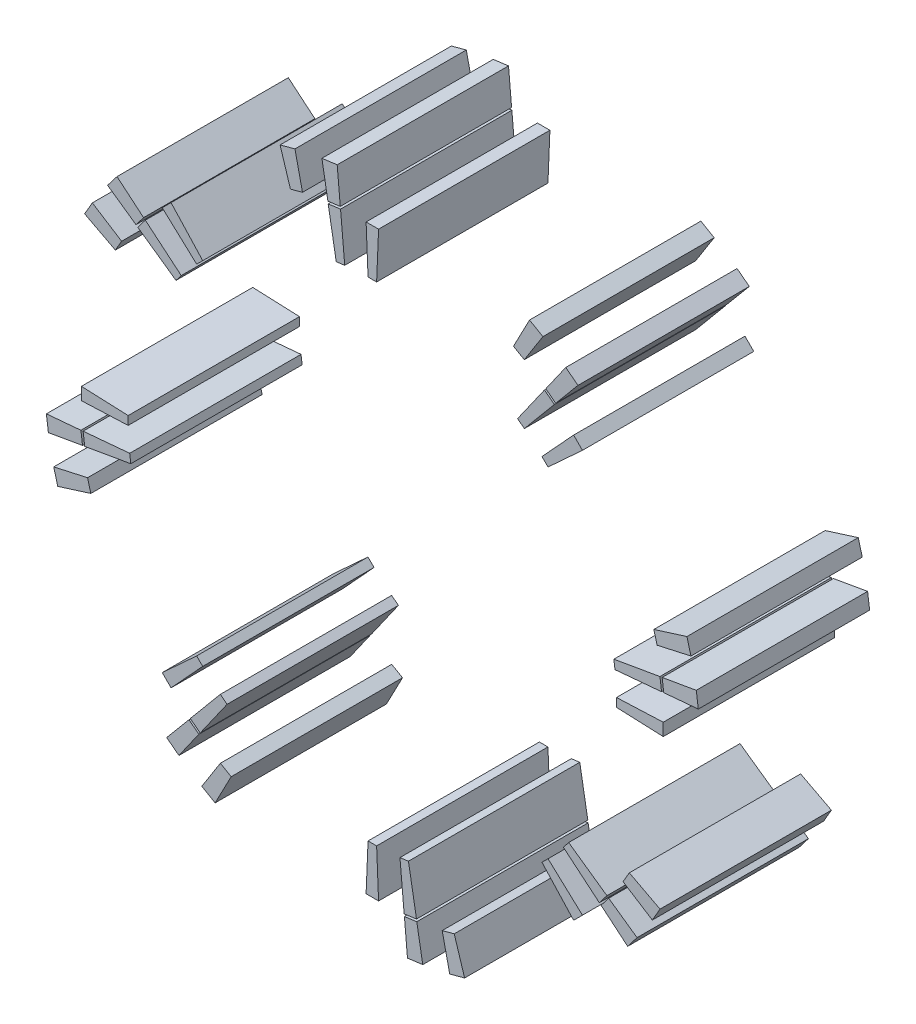
from build123d import *

# Parameters (mm, degrees)
SLOT_COPPER_ENVELOPES_START    = -15
SLOT_COPPER_ENVELOPES_DEPTH    = 30
SLOT_COPPER_ENVELOPES_2_DEPTH  = 30
SLOT_COPPER_ENVELOPES_3_DEPTH  = 30
SLOT_COPPER_ENVELOPES_4_DEPTH  = 30
SLOT_COPPER_ENVELOPES_5_DEPTH  = 30
SLOT_COPPER_ENVELOPES_6_DEPTH  = 30
SLOT_COPPER_ENVELOPES_7_DEPTH  = 30
SLOT_COPPER_ENVELOPES_8_DEPTH  = 30
SLOT_COPPER_ENVELOPES_9_DEPTH  = 30
SLOT_COPPER_ENVELOPES_10_DEPTH = 30
SLOT_COPPER_ENVELOPES_11_DEPTH = 30
SLOT_COPPER_ENVELOPES_12_DEPTH = 30
SLOT_COPPER_ENVELOPES_13_DEPTH = 30
SLOT_COPPER_ENVELOPES_14_DEPTH = 30
SLOT_COPPER_ENVELOPES_15_DEPTH = 30
SLOT_COPPER_ENVELOPES_16_DEPTH = 30
SLOT_COPPER_ENVELOPES_17_DEPTH = 30
SLOT_COPPER_ENVELOPES_18_DEPTH = 30
SLOT_COPPER_ENVELOPES_19_DEPTH = 30
SLOT_COPPER_ENVELOPES_20_DEPTH = 30
SLOT_COPPER_ENVELOPES_21_DEPTH = 30
SLOT_COPPER_ENVELOPES_22_DEPTH = 30
SLOT_COPPER_ENVELOPES_23_DEPTH = 30
SLOT_COPPER_ENVELOPES_24_DEPTH = 30
SLOT_COPPER_ENVELOPES_25_DEPTH = 30
SLOT_COPPER_ENVELOPES_26_DEPTH = 30
SLOT_COPPER_ENVELOPES_27_DEPTH = 30
SLOT_COPPER_ENVELOPES_28_DEPTH = 30
SLOT_COPPER_ENVELOPES_29_DEPTH = 30
SLOT_COPPER_ENVELOPES_30_DEPTH = 30
SLOT_COPPER_ENVELOPES_31_DEPTH = 30
SLOT_COPPER_ENVELOPES_32_DEPTH = 30


with BuildPart() as part:
    # Эскиз1 → Slot_copper_envelopes (new body)
    with BuildSketch(Plane.XY.offset(SLOT_COPPER_ENVELOPES_START)):
        Polygon((42.754960783, -0.75), (50.938461538, -1.091818182), (50.938461538, 1.091818182), (42.754960783, 0.75), align=None)
    extrude(amount=SLOT_COPPER_ENVELOPES_DEPTH)


with BuildPart() as body_2:
    # Эскиз1 → Slot_copper_envelopes 2 (new body)
    with BuildSketch(Plane.XY.offset(SLOT_COPPER_ENVELOPES_START)):
        Polygon((51.030252894, 5.617020808), (57.077518903, 6.152748823), (56.725098184, 8.829649949), (50.745231154, 7.78197586), align=None)
    extrude(amount=SLOT_COPPER_ENVELOPES_2_DEPTH)


with BuildPart() as body_3:
    # Эскиз1 → Slot_copper_envelopes 3 (new body)
    with BuildSketch(Plane.XY.offset(SLOT_COPPER_ENVELOPES_START)):
        Polygon((42.487080811, 4.837058584), (50.645186808, 5.566325896), (50.360165069, 7.731280948), (42.291291523, 6.324225876), align=None)
    extrude(amount=SLOT_COPPER_ENVELOPES_3_DEPTH)


with BuildPart() as body_4:
    # Эскиз1 → Slot_copper_envelopes 4 (new body)
    with BuildSketch(Plane.XY.offset(SLOT_COPPER_ENVELOPES_START)):
        Polygon((49.860513668, 12.229751015), (55.786117941, 13.550222408), (55.087306519, 16.158222139), (49.29534699, 14.338981773), align=None)
    extrude(amount=SLOT_COPPER_ENVELOPES_4_DEPTH)


with BuildPart() as body_5:
    # Эскиз1 → Slot_copper_envelopes 5 (new body)
    with BuildSketch(Plane.XY.offset(SLOT_COPPER_ENVELOPES_START)):
        Polygon((30.762652785, 29.701992613), (36.790963617, 35.246899537), (35.246899537, 36.790963617), (29.701992613, 30.762652785), align=None)
    extrude(amount=SLOT_COPPER_ENVELOPES_5_DEPTH)


with BuildPart() as body_6:
    # Эскиз1 → Slot_copper_envelopes 6 (new body)
    with BuildSketch(Plane.XY.offset(SLOT_COPPER_ENVELOPES_START)):
        Polygon((32.112004363, 40.05567137), (36.009250254, 44.710551086), (33.867196235, 46.354206944), (30.37960916, 41.384984963), align=None)
    extrude(amount=SLOT_COPPER_ENVELOPES_6_DEPTH)


with BuildPart() as body_7:
    # Эскиз1 → Slot_copper_envelopes 7 (new body)
    with BuildSketch(Plane.XY.offset(SLOT_COPPER_ENVELOPES_START)):
        Polygon((26.622586029, 33.46321988), (31.875568239, 39.747541814), (30.143173036, 41.076855407), (25.432556019, 34.376362023), align=None)
    extrude(amount=SLOT_COPPER_ENVELOPES_7_DEPTH)


with BuildPart() as body_8:
    # Эскиз1 → Slot_copper_envelopes 8 (new body)
    with BuildSketch(Plane.XY.offset(SLOT_COPPER_ENVELOPES_START)):
        Polygon((26.608967454, 43.904447203), (29.865288141, 49.028196443), (27.527019551, 50.378196443), (24.71788289, 44.996265385), align=None)
    extrude(amount=SLOT_COPPER_ENVELOPES_8_DEPTH)


with BuildPart() as body_9:
    # Эскиз1 → Slot_copper_envelopes 9 (new body)
    with BuildSketch(Plane.XY.offset(SLOT_COPPER_ENVELOPES_START)):
        Polygon((0.75, 42.754960783), (1.091818182, 50.938461538), (-1.091818182, 50.938461538), (-0.75, 42.754960783), align=None)
    extrude(amount=SLOT_COPPER_ENVELOPES_9_DEPTH)


with BuildPart() as body_10:
    # Эскиз1 → Slot_copper_envelopes 10 (new body)
    with BuildSketch(Plane.XY.offset(SLOT_COPPER_ENVELOPES_START)):
        Polygon((-5.617020808, 51.030252894), (-6.152748823, 57.077518903), (-8.829649949, 56.725098184), (-7.78197586, 50.745231154), align=None)
    extrude(amount=SLOT_COPPER_ENVELOPES_10_DEPTH)


with BuildPart() as body_11:
    # Эскиз1 → Slot_copper_envelopes 11 (new body)
    with BuildSketch(Plane.XY.offset(SLOT_COPPER_ENVELOPES_START)):
        Polygon((-4.837058584, 42.487080811), (-5.566325896, 50.645186808), (-7.731280948, 50.360165069), (-6.324225876, 42.291291523), align=None)
    extrude(amount=SLOT_COPPER_ENVELOPES_11_DEPTH)


with BuildPart() as body_12:
    # Эскиз1 → Slot_copper_envelopes 12 (new body)
    with BuildSketch(Plane.XY.offset(SLOT_COPPER_ENVELOPES_START)):
        Polygon((-12.229751015, 49.860513668), (-13.550222408, 55.786117941), (-16.158222139, 55.087306519), (-14.338981773, 49.29534699), align=None)
    extrude(amount=SLOT_COPPER_ENVELOPES_12_DEPTH)


with BuildPart() as body_13:
    # Эскиз1 → Slot_copper_envelopes 13 (new body)
    with BuildSketch(Plane.XY.offset(SLOT_COPPER_ENVELOPES_START)):
        Polygon((-29.701992613, 30.762652785), (-35.246899537, 36.790963617), (-36.790963617, 35.246899537), (-30.762652785, 29.701992613), align=None)
    extrude(amount=SLOT_COPPER_ENVELOPES_13_DEPTH)


with BuildPart() as body_14:
    # Эскиз1 → Slot_copper_envelopes 14 (new body)
    with BuildSketch(Plane.XY.offset(SLOT_COPPER_ENVELOPES_START)):
        Polygon((-40.05567137, 32.112004363), (-44.710551086, 36.009250254), (-46.354206944, 33.867196235), (-41.384984963, 30.37960916), align=None)
    extrude(amount=SLOT_COPPER_ENVELOPES_14_DEPTH)


with BuildPart() as body_15:
    # Эскиз1 → Slot_copper_envelopes 15 (new body)
    with BuildSketch(Plane.XY.offset(SLOT_COPPER_ENVELOPES_START)):
        Polygon((-33.46321988, 26.622586029), (-39.747541814, 31.875568239), (-41.076855407, 30.143173036), (-34.376362023, 25.432556019), align=None)
    extrude(amount=SLOT_COPPER_ENVELOPES_15_DEPTH)


with BuildPart() as body_16:
    # Эскиз1 → Slot_copper_envelopes 16 (new body)
    with BuildSketch(Plane.XY.offset(SLOT_COPPER_ENVELOPES_START)):
        Polygon((-43.904447203, 26.608967454), (-49.028196443, 29.865288141), (-50.378196443, 27.527019551), (-44.996265385, 24.71788289), align=None)
    extrude(amount=SLOT_COPPER_ENVELOPES_16_DEPTH)


with BuildPart() as body_17:
    # Эскиз1 → Slot_copper_envelopes 17 (new body)
    with BuildSketch(Plane.XY.offset(SLOT_COPPER_ENVELOPES_START)):
        Polygon((-42.754960783, 0.75), (-50.938461538, 1.091818182), (-50.938461538, -1.091818182), (-42.754960783, -0.75), align=None)
    extrude(amount=SLOT_COPPER_ENVELOPES_17_DEPTH)


with BuildPart() as body_18:
    # Эскиз1 → Slot_copper_envelopes 18 (new body)
    with BuildSketch(Plane.XY.offset(SLOT_COPPER_ENVELOPES_START)):
        Polygon((-51.030252894, -5.617020808), (-57.077518903, -6.152748823), (-56.725098184, -8.829649949), (-50.745231154, -7.78197586), align=None)
    extrude(amount=SLOT_COPPER_ENVELOPES_18_DEPTH)


with BuildPart() as body_19:
    # Эскиз1 → Slot_copper_envelopes 19 (new body)
    with BuildSketch(Plane.XY.offset(SLOT_COPPER_ENVELOPES_START)):
        Polygon((-42.487080811, -4.837058584), (-50.645186808, -5.566325896), (-50.360165069, -7.731280948), (-42.291291523, -6.324225876), align=None)
    extrude(amount=SLOT_COPPER_ENVELOPES_19_DEPTH)


with BuildPart() as body_20:
    # Эскиз1 → Slot_copper_envelopes 20 (new body)
    with BuildSketch(Plane.XY.offset(SLOT_COPPER_ENVELOPES_START)):
        Polygon((-49.860513668, -12.229751015), (-55.786117941, -13.550222408), (-55.087306519, -16.158222139), (-49.29534699, -14.338981773), align=None)
    extrude(amount=SLOT_COPPER_ENVELOPES_20_DEPTH)


with BuildPart() as body_21:
    # Эскиз1 → Slot_copper_envelopes 21 (new body)
    with BuildSketch(Plane.XY.offset(SLOT_COPPER_ENVELOPES_START)):
        Polygon((-30.762652785, -29.701992613), (-36.790963617, -35.246899537), (-35.246899537, -36.790963617), (-29.701992613, -30.762652785), align=None)
    extrude(amount=SLOT_COPPER_ENVELOPES_21_DEPTH)


with BuildPart() as body_22:
    # Эскиз1 → Slot_copper_envelopes 22 (new body)
    with BuildSketch(Plane.XY.offset(SLOT_COPPER_ENVELOPES_START)):
        Polygon((-32.112004363, -40.05567137), (-36.009250254, -44.710551086), (-33.867196235, -46.354206944), (-30.37960916, -41.384984963), align=None)
    extrude(amount=SLOT_COPPER_ENVELOPES_22_DEPTH)


with BuildPart() as body_23:
    # Эскиз1 → Slot_copper_envelopes 23 (new body)
    with BuildSketch(Plane.XY.offset(SLOT_COPPER_ENVELOPES_START)):
        Polygon((-26.622586029, -33.46321988), (-31.875568239, -39.747541814), (-30.143173036, -41.076855407), (-25.432556019, -34.376362023), align=None)
    extrude(amount=SLOT_COPPER_ENVELOPES_23_DEPTH)


with BuildPart() as body_24:
    # Эскиз1 → Slot_copper_envelopes 24 (new body)
    with BuildSketch(Plane.XY.offset(SLOT_COPPER_ENVELOPES_START)):
        Polygon((-26.608967454, -43.904447203), (-29.865288141, -49.028196443), (-27.527019551, -50.378196443), (-24.71788289, -44.996265385), align=None)
    extrude(amount=SLOT_COPPER_ENVELOPES_24_DEPTH)


with BuildPart() as body_25:
    # Эскиз1 → Slot_copper_envelopes 25 (new body)
    with BuildSketch(Plane.XY.offset(SLOT_COPPER_ENVELOPES_START)):
        Polygon((-0.75, -42.754960783), (-1.091818182, -50.938461538), (1.091818182, -50.938461538), (0.75, -42.754960783), align=None)
    extrude(amount=SLOT_COPPER_ENVELOPES_25_DEPTH)


with BuildPart() as body_26:
    # Эскиз1 → Slot_copper_envelopes 26 (new body)
    with BuildSketch(Plane.XY.offset(SLOT_COPPER_ENVELOPES_START)):
        Polygon((5.617020808, -51.030252894), (6.152748823, -57.077518903), (8.829649949, -56.725098184), (7.78197586, -50.745231154), align=None)
    extrude(amount=SLOT_COPPER_ENVELOPES_26_DEPTH)


with BuildPart() as body_27:
    # Эскиз1 → Slot_copper_envelopes 27 (new body)
    with BuildSketch(Plane.XY.offset(SLOT_COPPER_ENVELOPES_START)):
        Polygon((4.837058584, -42.487080811), (5.566325896, -50.645186808), (7.731280948, -50.360165069), (6.324225876, -42.291291523), align=None)
    extrude(amount=SLOT_COPPER_ENVELOPES_27_DEPTH)


with BuildPart() as body_28:
    # Эскиз1 → Slot_copper_envelopes 28 (new body)
    with BuildSketch(Plane.XY.offset(SLOT_COPPER_ENVELOPES_START)):
        Polygon((12.229751015, -49.860513668), (13.550222408, -55.786117941), (16.158222139, -55.087306519), (14.338981773, -49.29534699), align=None)
    extrude(amount=SLOT_COPPER_ENVELOPES_28_DEPTH)


with BuildPart() as body_29:
    # Эскиз1 → Slot_copper_envelopes 29 (new body)
    with BuildSketch(Plane.XY.offset(SLOT_COPPER_ENVELOPES_START)):
        Polygon((29.701992613, -30.762652785), (35.246899537, -36.790963617), (36.790963617, -35.246899537), (30.762652785, -29.701992613), align=None)
    extrude(amount=SLOT_COPPER_ENVELOPES_29_DEPTH)


with BuildPart() as body_30:
    # Эскиз1 → Slot_copper_envelopes 30 (new body)
    with BuildSketch(Plane.XY.offset(SLOT_COPPER_ENVELOPES_START)):
        Polygon((40.05567137, -32.112004363), (44.710551086, -36.009250254), (46.354206944, -33.867196235), (41.384984963, -30.37960916), align=None)
    extrude(amount=SLOT_COPPER_ENVELOPES_30_DEPTH)


with BuildPart() as body_31:
    # Эскиз1 → Slot_copper_envelopes 31 (new body)
    with BuildSketch(Plane.XY.offset(SLOT_COPPER_ENVELOPES_START)):
        Polygon((33.46321988, -26.622586029), (39.747541814, -31.875568239), (41.076855407, -30.143173036), (34.376362023, -25.432556019), align=None)
    extrude(amount=SLOT_COPPER_ENVELOPES_31_DEPTH)


with BuildPart() as body_32:
    # Эскиз1 → Slot_copper_envelopes 32 (new body)
    with BuildSketch(Plane.XY.offset(SLOT_COPPER_ENVELOPES_START)):
        Polygon((43.904447203, -26.608967454), (49.028196443, -29.865288141), (50.378196443, -27.527019551), (44.996265385, -24.71788289), align=None)
    extrude(amount=SLOT_COPPER_ENVELOPES_32_DEPTH)


solid = Compound([part.part, body_2.part, body_3.part, body_4.part, body_5.part, body_6.part, body_7.part, body_8.part, body_9.part, body_10.part, body_11.part, body_12.part, body_13.part, body_14.part, body_15.part, body_16.part, body_17.part, body_18.part, body_19.part, body_20.part, body_21.part, body_22.part, body_23.part, body_24.part, body_25.part, body_26.part, body_27.part, body_28.part, body_29.part, body_30.part, body_31.part, body_32.part])
